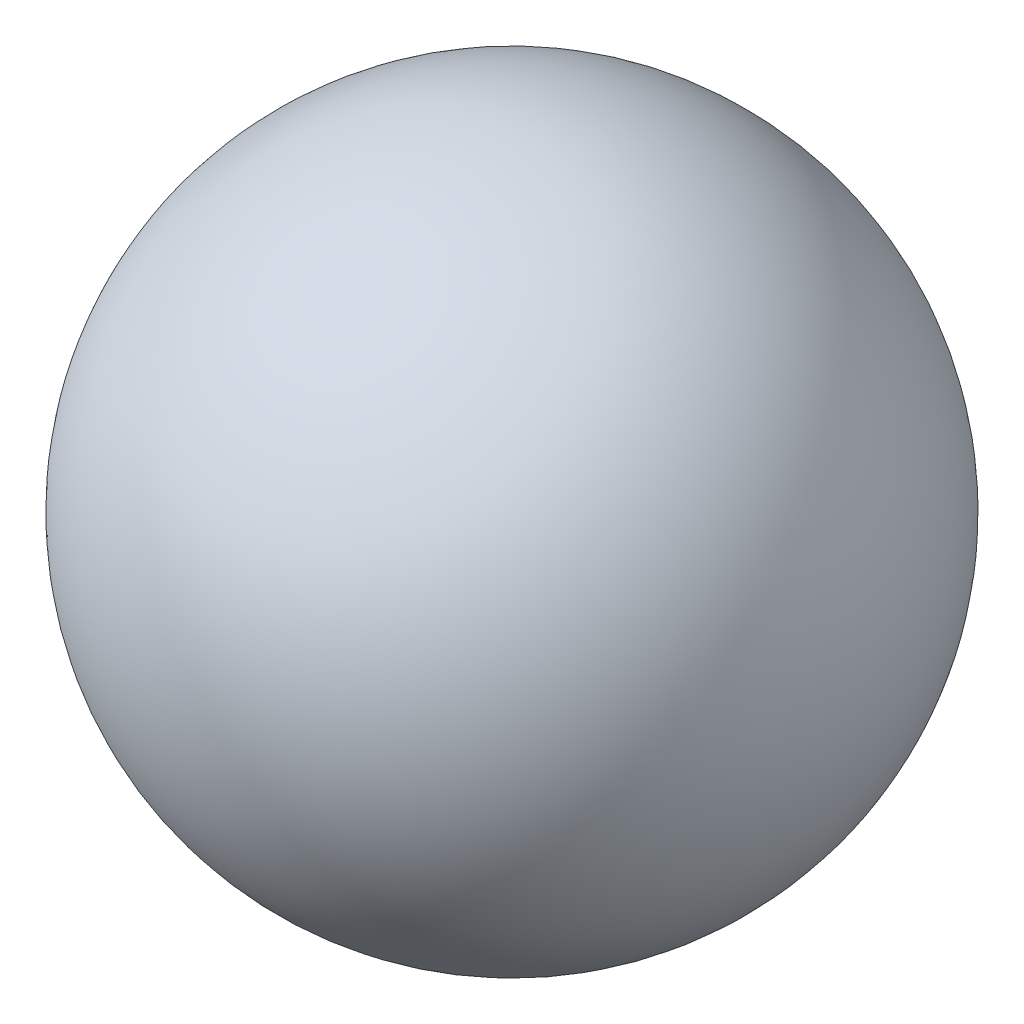
from build123d import *


with BuildPart() as part:
    # Sketch1 → Revolve1 (revolve)
    with BuildSketch(Plane.XY):
        with BuildLine():
            Line((-88, 0), (-87, 0))
            ThreePointArc((-87, 0), (0, 87), (87, 0))
            Line((87, 0), (88, 0))
            ThreePointArc((88, 0), (0, 88), (-88, 0))
        make_face()
    revolve(axis=Axis((-87, 0, 0), (1, 0, 0)))


solid = part.part
